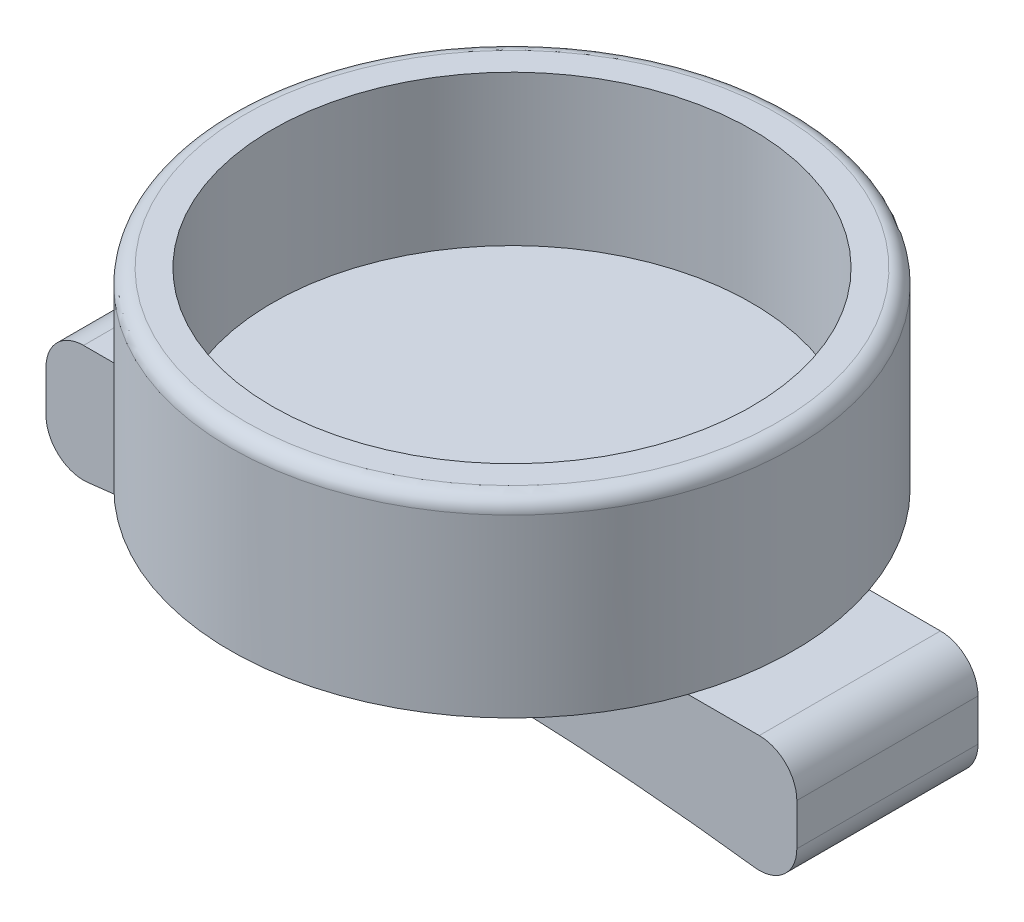
from build123d import *

# Parameters (mm, degrees)
SKETCH1_R                = 7.5
SKETCH1_R_2              = 2.3241
BOSS_EXTRUDE1_DEPTH      = 2.794
SKETCH2_R                = 2.3241
BOSS_EXTRUDE2_DEPTH      = 0.254
BOSS_EXTRUDE3_DEPTH      = 1.651
BOSS_EXTRUDE4_START      = 2.286
SKETCH4_R                = 7.5
BOSS_EXTRUDE4_DEPTH      = 2.286
FILLET1_R                = 0.254
FILLET2_R                = 0.127
FILLET3_R                = 0.4
SKETCH6_W                = 4.02205745
SKETCH6_H                = 1.558094328
BOSS_EXTRUDE5_DEPTH      = 2.54
BOSS_EXTRUDE6_DEPTH      = 2.413
BOSS_EXTRUDE6_DEPTH_BACK = 2.413
CUT_EXTRUDE2_START       = -4
SKETCH5_R                = 6.3875
SKETCH5_R_2              = 2.3241
CUT_EXTRUDE2_DEPTH       = 4


with BuildPart() as part:
    # Sketch1 → Boss-Extrude1 (new body)
    with BuildSketch(Plane(origin=(0, 0, 0), x_dir=(1, 0, 0), z_dir=(0, 1, 0))):
        with Locations(Location((0, 0, 0), (0, 0, 270))):
            Circle(SKETCH1_R)
        with Locations(Location((0, 0, 0), (0, 0, 270))):
            Circle(SKETCH1_R_2, mode=Mode.SUBTRACT)
    extrude(amount=BOSS_EXTRUDE1_DEPTH)

    # Sketch2 → Boss-Extrude2 (add)
    with BuildSketch(Plane.XZ):
        with Locations(Location((0, 0, 0), (0, 0, 270))):
            Circle(SKETCH2_R)
    extrude(amount=-BOSS_EXTRUDE2_DEPTH)

    # Sketch3 → Boss-Extrude3 (add)
    with BuildSketch(Plane(origin=(0, 0.254, 0), x_dir=(1, 0, 0), z_dir=(0, 1, 0))):
        with BuildLine():
            Line((-0.495805164, 1.156686678), (0.614449488, 1.120298857))
            ThreePointArc((0.614449488, 1.120298857), (0.708812351, 1.091670316), (0.776218716, 1.01969584))
            Line((0.776218716, 1.01969584), (1.299833265, 0.039993196))
            ThreePointArc((1.299833265, 0.039993196), (1.322221652, -0.056041711), (1.293593111, -0.150404573))
            Line((1.293593111, -0.150404573), (0.706953007, -1.093719397))
            ThreePointArc((0.706953007, -1.093719397), (0.634978532, -1.161125762), (0.538943625, -1.183514149))
            Line((0.538943625, -1.183514149), (-0.571311028, -1.147126328))
            ThreePointArc((-0.571311028, -1.147126328), (-0.66567389, -1.118497787), (-0.733080255, -1.046523312))
            Line((-0.733080255, -1.046523312), (-1.256694804, -0.066820667))
            ThreePointArc((-1.256694804, -0.066820667), (-1.279083191, 0.02921424), (-1.25045465, 0.123577102))
            Line((-1.25045465, 0.123577102), (-0.663814546, 1.066891925))
            ThreePointArc((-0.663814546, 1.066891925), (-0.591840071, 1.134298291), (-0.495805164, 1.156686678))
        make_face()
    extrude(amount=BOSS_EXTRUDE3_DEPTH)

    # Sketch4 → Boss-Extrude4 (add)
    with BuildSketch(Plane.XZ.offset(BOSS_EXTRUDE4_START)):
        with Locations(Location((0, 0, 0), (0, 0, 270))):
            Circle(SKETCH4_R)
    extrude(amount=-BOSS_EXTRUDE4_DEPTH)

    # Fillet1
    fillet1_edges = [part.edges().sort_by_distance(p)[0] for p in [
        (0, 0.254, -2.3241),
        (0.708812351, 0.254, -1.091670316),
        (0.059322162, 0.254, -1.138492768),
        (-0.591840071, 0.254, -1.134298291),
        (-0.957134598, 0.254, -0.595234514),
        (-1.279083191, 0.254, -0.02921424),
        (-0.99488753, 0.254, 0.556671989),
        (-0.66567389, 0.254, 1.118497787),
        (-0.016183701, 0.254, 1.165320239),
        (0.634978532, 0.254, 1.161125762),
        (1.000273059, 0.254, 0.622061985),
        (1.322221652, 0.254, 0.056041711),
        (1.038025991, 0.254, -0.529844518),
    ]]
    fillet(fillet1_edges, radius=FILLET1_R)

    # Fillet2
    fillet2_edges = [part.edges().sort_by_distance(p)[0] for p in [
        (0.708812351, 1.905, -1.091670316),
        (0.059322162, 1.905, -1.138492768),
        (-0.591840071, 1.905, -1.134298291),
        (-0.957134598, 1.905, -0.595234514),
        (-1.279083191, 1.905, -0.02921424),
        (-0.99488753, 1.905, 0.556671989),
        (-0.66567389, 1.905, 1.118497787),
        (-0.016183701, 1.905, 1.165320239),
        (0.634978532, 1.905, 1.161125762),
        (1.000273059, 1.905, 0.622061985),
        (1.322221652, 1.905, 0.056041711),
        (1.038025991, 1.905, -0.529844518),
    ]]
    fillet(fillet2_edges, radius=FILLET2_R)

    # Fillet3
    fillet3_edges = [part.edges().sort_by_distance(p)[0] for p in [
        (0, 2.794, -7.5),
    ]]
    fillet(fillet3_edges, radius=FILLET3_R)

    # Sketch6 → Boss-Extrude5 (add)
    with BuildSketch(Plane.XZ.offset(2.286)):
        Rectangle(SKETCH6_W, SKETCH6_H)
    extrude(amount=BOSS_EXTRUDE5_DEPTH)

    # Sketch7 → Boss-Extrude6 (add, two sides: drawn at the far end of the back side and taken through both)
    with BuildSketch(Plane(origin=(0, 0, 0), x_dir=(-1, 0, 0), z_dir=(0, 0, -1)).offset(-BOSS_EXTRUDE6_DEPTH_BACK)):
        with BuildLine():
            Line((8.999999188, -2.286), (-8.999999188, -2.286))
            ThreePointArc((-8.999999188, -2.286), (-9.707105969, -2.578893219), (-9.999999188, -3.286))
            Line((-9.999999188, -3.286), (-9.999999188, -4.398115656))
            ThreePointArc((-9.999999188, -4.398115656), (-9.660822486, -5.148657173), (-8.873374049, -5.390066297))
            ThreePointArc((-8.873374049, -5.390066297), (0, -4.826), (8.873374049, -5.390066297))
            ThreePointArc((8.873374049, -5.390066297), (9.660822486, -5.148657173), (9.999999188, -4.398115656))
            Line((9.999999188, -4.398115656), (9.999999188, -3.286))
            ThreePointArc((9.999999188, -3.286), (9.707105969, -2.578893219), (8.999999188, -2.286))
        make_face()
    extrude(amount=BOSS_EXTRUDE6_DEPTH + BOSS_EXTRUDE6_DEPTH_BACK)

    # Sketch5 → Cut-Extrude2 (cut)
    # profile 1 of 2: a face of its own
    with BuildSketch(Plane(origin=(0, 2.794, 0), x_dir=(1, 0, 0), z_dir=(0, 1, 0)).offset(CUT_EXTRUDE2_START)):
        with Locations(Location((0, 0, 0), (0, 0, 270))):
            Circle(SKETCH5_R)
        Circle(SKETCH5_R_2, mode=Mode.SUBTRACT)
    # profile 2 of 2: a face of its own
    with BuildSketch(Plane(origin=(0, 2.794, 0), x_dir=(1, 0, 0), z_dir=(0, 1, 0)).offset(CUT_EXTRUDE2_START)):
        Circle(SKETCH5_R_2)
    extrude(amount=CUT_EXTRUDE2_DEPTH, mode=Mode.SUBTRACT)

    # Sketch11 → Revolve3 (revolve)
    with BuildSketch(Plane(origin=(0, 0, 0), x_dir=(-1, 0, 0), z_dir=(0, 0, -1)), mode=Mode.PRIVATE) as revolve3_sk:
        Polygon((-7.101227429, -2.286), (-7.5, -2.286), (0, -4.826), (0, -2.286), align=None)
    revolve(revolve3_sk.sketch.rotate(Axis((0, -1.206, 0), (0, 1, 0)), 18.767781972), axis=Axis((0, -1.206, 0), (0, 1, 0)))


solid = part.part
